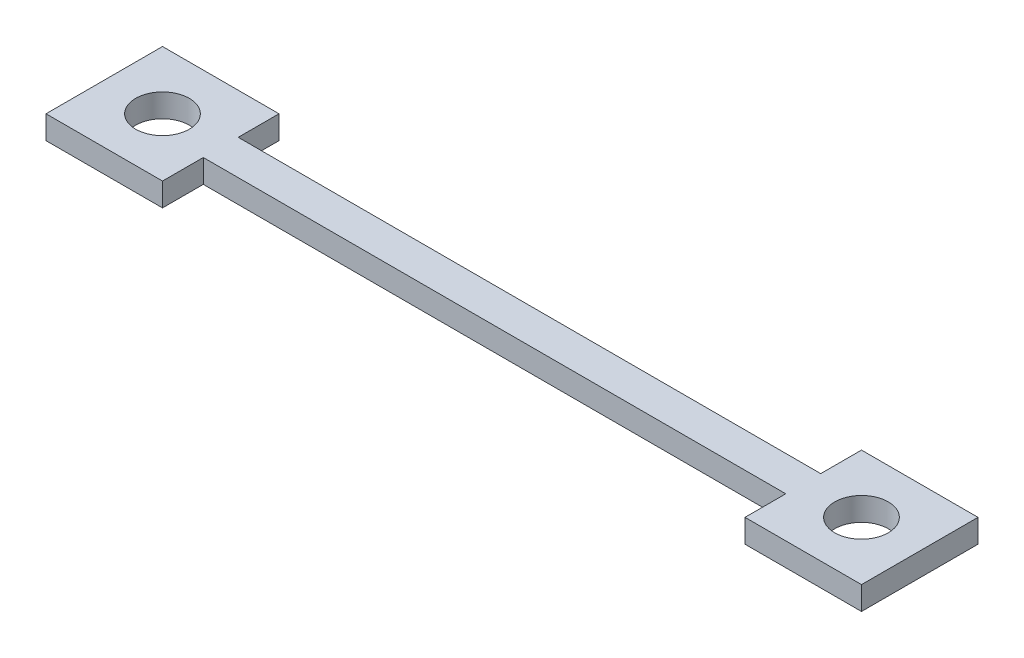
from build123d import *

# Parameters (mm, degrees)
BOSS_EXTRUDE1_DEPTH          = 0.635
F_97_0_0059_DIAMETER_HOLE1_D = 2.921


with BuildPart() as part:
    # Sketch1 → Boss-Extrude1 (new, symmetric)
    with BuildSketch(Plane(origin=(0, 0, 0), x_dir=(1, 0, 0), z_dir=(0, 1, 0))):
        Polygon((-41.424046485, -10.283259465), (-41.424046485, -12.505759465), (-47.774046485, -12.505759465), (-47.774046485, -6.155759465), (-41.424046485, -6.155759465), (-41.424046485, -8.378259465), (-9.674046485, -8.378259465), (-9.674046485, -6.155759465), (-3.324046485, -6.155759465), (-3.324046485, -12.505759465), (-9.674046485, -12.505759465), (-9.674046485, -10.283259465), align=None)
    extrude(amount=BOSS_EXTRUDE1_DEPTH, both=True)

    # #97 (0.0059) Diameter Hole1 (through all)
    with Locations(Plane(origin=(0, 0.635, 0), x_dir=(-1, 0, 0), z_dir=(0, 1, 0))):
        with Locations((44.599046485, 9.330759465)):
            f_97_0_0059_diameter_hole1 = Hole(F_97_0_0059_DIAMETER_HOLE1_D / 2)

    # Mirror1: #97 (0.0059) Diameter Hole1 across plane
    add(f_97_0_0059_diameter_hole1.mirror(Plane(origin=(-25.549046485, 0, 0), x_dir=(0, 0, 1), z_dir=(1, 0, 0))), mode=Mode.SUBTRACT)


solid = part.part
